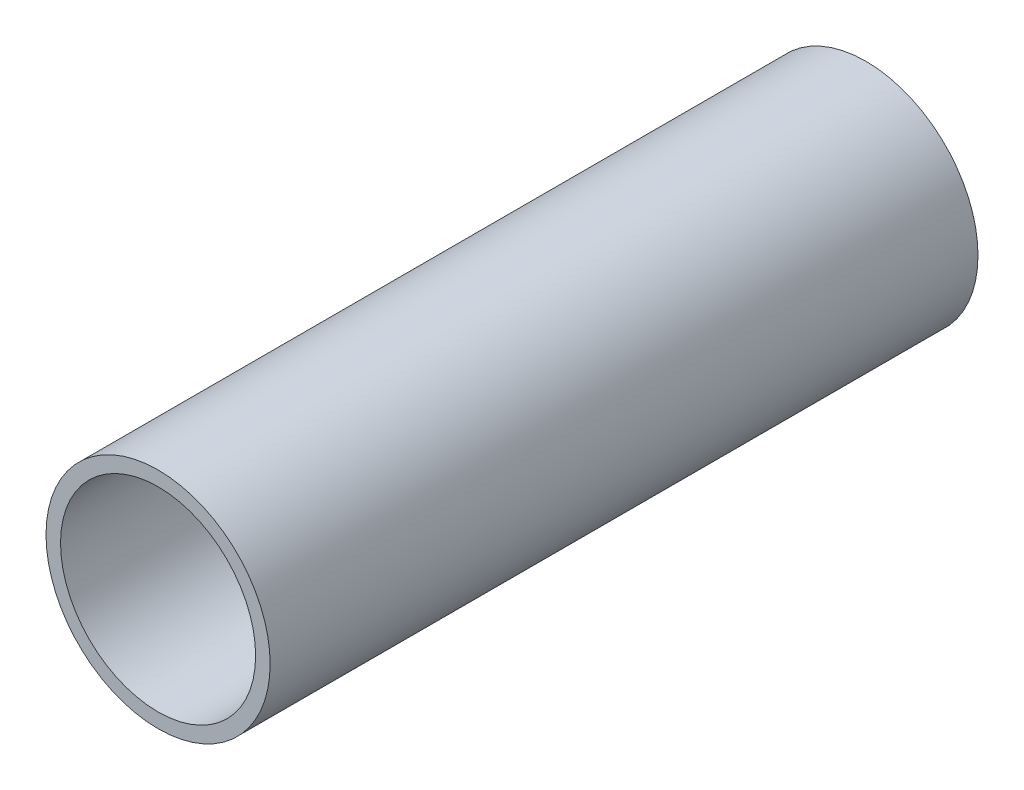
from build123d import *

# Parameters (mm, degrees)
SKETCH1_R           = 30.1625
SKETCH1_R_2         = 26.2509
BOSS_EXTRUDE1_DEPTH = 190.5


with BuildPart() as part:
    # Sketch1 → Boss-Extrude1 (new body)
    with BuildSketch(Plane.XY):
        Circle(SKETCH1_R)
        Circle(SKETCH1_R_2, mode=Mode.SUBTRACT)
    extrude(amount=BOSS_EXTRUDE1_DEPTH)


solid = part.part
